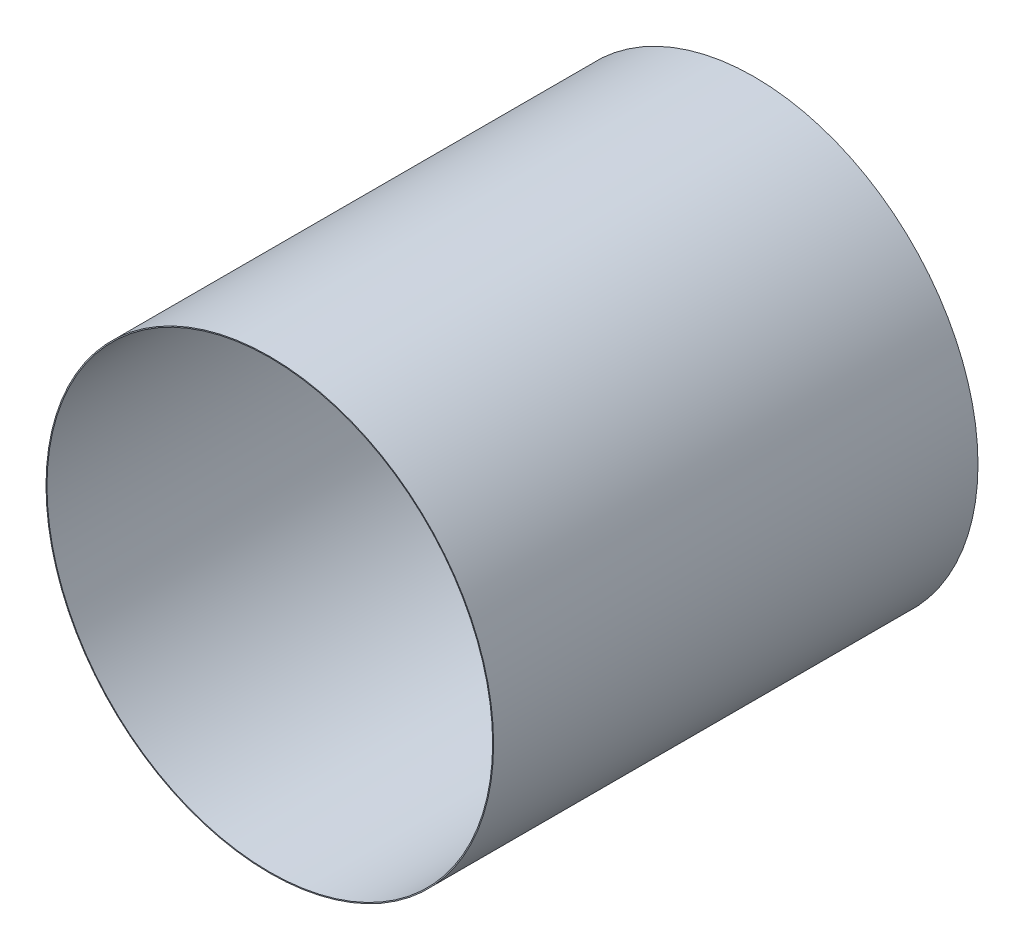
from build123d import *

# Parameters (mm, degrees)
SKETCH1_R           = 11.55
SKETCH1_R_2         = 11.5
BOSS_EXTRUDE1_DEPTH = 25


with BuildPart() as part:
    # Sketch1 → Boss-Extrude1 (new body)
    with BuildSketch(Plane.XY):
        Circle(SKETCH1_R)
        Circle(SKETCH1_R_2, mode=Mode.SUBTRACT)
    extrude(amount=BOSS_EXTRUDE1_DEPTH)


solid = part.part
